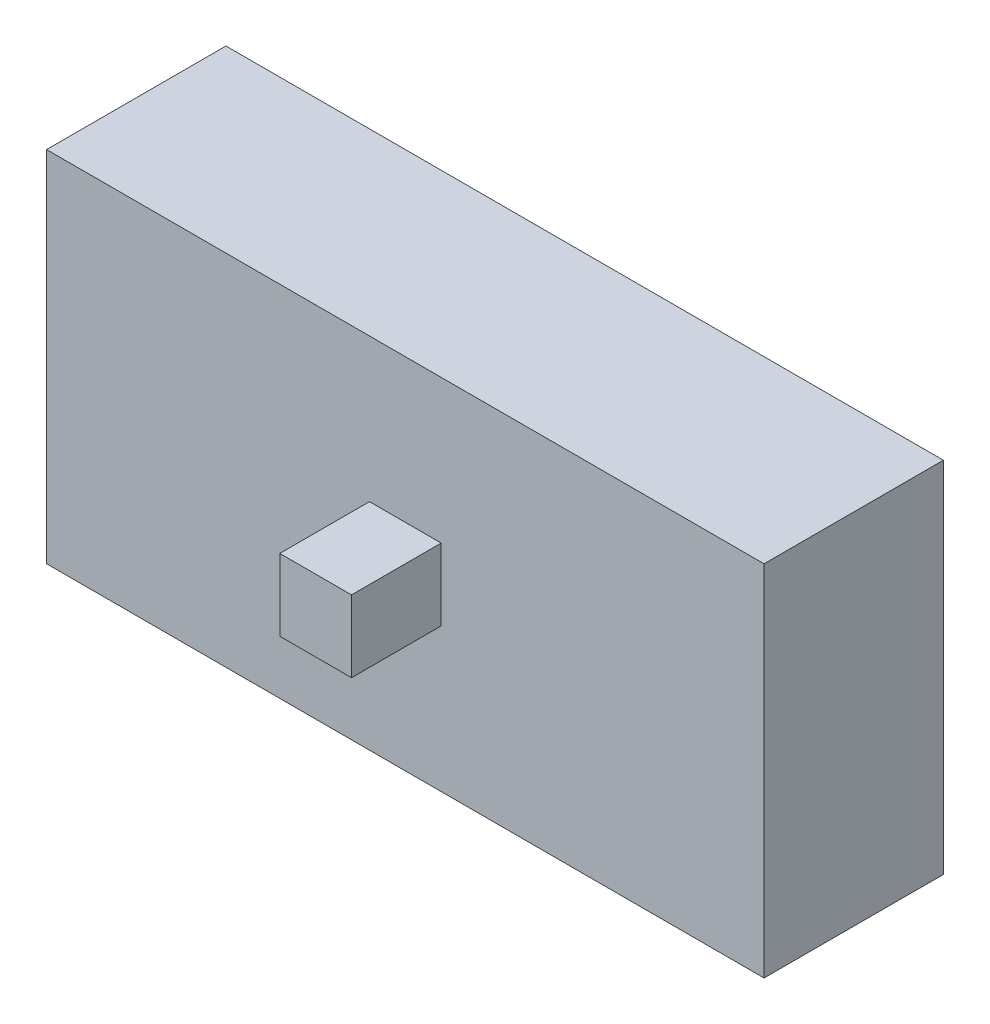
from build123d import *

# Parameters (mm, degrees)
SKETCH1_W           = 40
SKETCH1_H           = 20
BOSS_EXTRUDE1_DEPTH = 10
SKETCH2_W           = 4
SKETCH2_H           = 4
BOSS_EXTRUDE2_DEPTH = 5


with BuildPart() as part:
    # Sketch1 → Boss-Extrude1 (new body)
    with BuildSketch(Plane.XY):
        with Locations((20, 10)):
            Rectangle(SKETCH1_W, SKETCH1_H)
    extrude(amount=BOSS_EXTRUDE1_DEPTH)

    # Sketch2 → Boss-Extrude2 (add)
    with BuildSketch(Plane.XY.offset(10)):
        with Locations((20, 10)):
            Rectangle(SKETCH2_W, SKETCH2_H)
    extrude(amount=BOSS_EXTRUDE2_DEPTH)


solid = part.part
